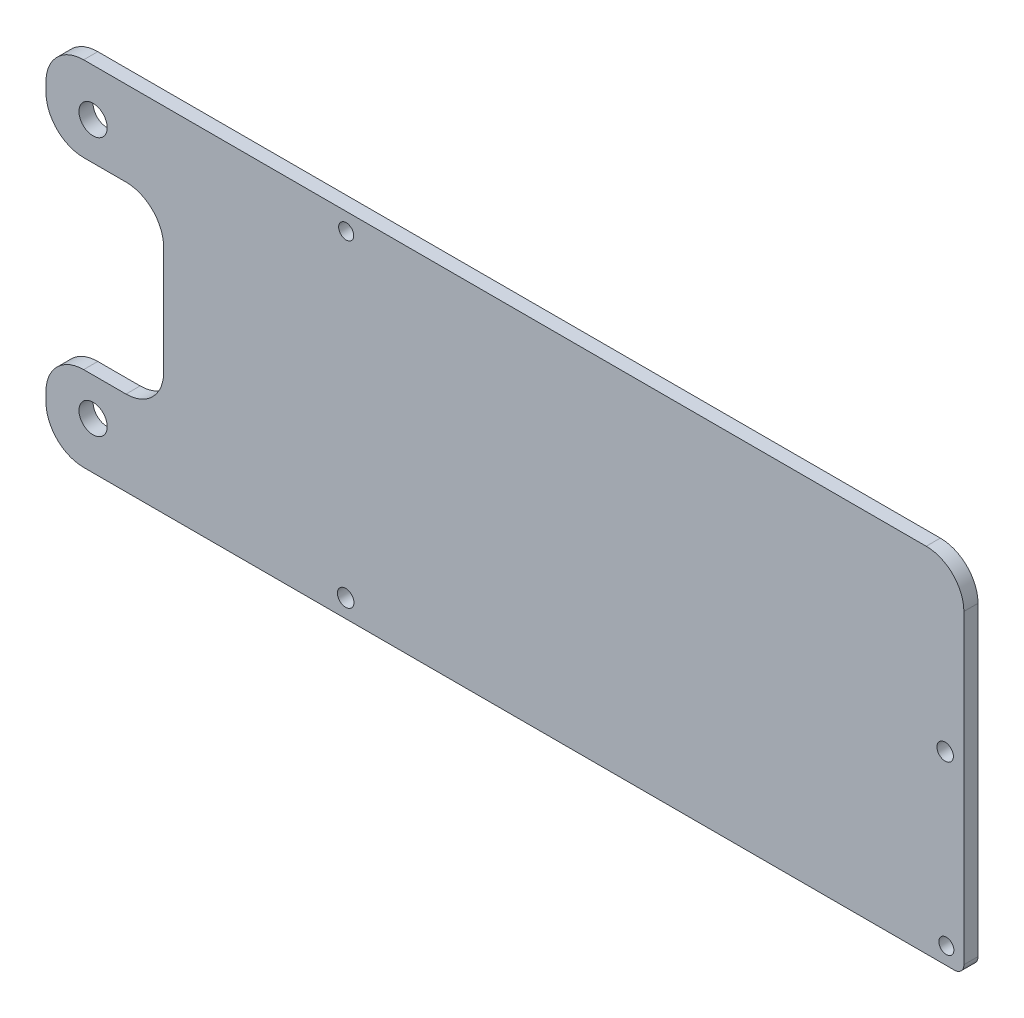
from build123d import *

# Parameters (mm, degrees)
SKETCH3_W           = 134.999984
SKETCH3_H           = 75.0000024
SKETCH3_R           = 1.5999968
SKETCH3_R_2         = 1.7499965
BOSS_EXTRUDE1_DEPTH = 3
FILLET1_R           = 8
FILLET2_R           = 2


with BuildPart() as part:
    # Sketch3 → Boss-Extrude1 (new body)
    # profile 1 of 4: a face of its own
    with BuildSketch(Plane.XY):
        with BuildLine():
            Line((10.0000054, 85.0000078), (-39.9999946, 85.0000078))
            Line((-39.9999946, 85.0000078), (-39.9999946, 78.0000078))
            ThreePointArc((-39.9999946, 78.0000078), (-37.878674256, 77.121328144), (-36.9999946, 75.0000078))
            ThreePointArc((-36.9999946, 75.0000078), (-37.878674256, 72.878687456), (-39.9999946, 72.0000078))
            Line((-39.9999946, 72.0000078), (-39.9999946, 67.0000078))
            Line((-39.9999946, 67.0000078), (-24.9999946, 67.0000078))
            Line((-24.9999946, 67.0000078), (-24.9999946, 28.0000054))
            Line((-24.9999946, 28.0000054), (-39.9999946, 28.0000054))
            Line((-39.9999946, 28.0000054), (-39.9999946, 23.0000054))
            ThreePointArc((-39.9999946, 23.0000054), (-37.878674256, 22.121325744), (-36.9999946, 20.0000054))
            ThreePointArc((-36.9999946, 20.0000054), (-37.878674256, 17.878685056), (-39.9999946, 17.0000054))
            Line((-39.9999946, 17.0000054), (-39.9999946, 10.0000054))
            Line((-39.9999946, 10.0000054), (10.0000054, 10.0000054))
            Line((10.0000054, 10.0000054), (10.0000054, 85.0000078))
        make_face()
    # profile 2 of 4: a face of its own
    with BuildSketch(Plane.XY):
        with BuildLine():
            Line((-39.9999946, 78.0000078), (-39.9999946, 85.0000078))
            Line((-39.9999946, 85.0000078), (-49.9999946, 85.0000078))
            Line((-49.9999946, 85.0000078), (-49.9999946, 67.0000078))
            Line((-49.9999946, 67.0000078), (-39.9999946, 67.0000078))
            Line((-39.9999946, 67.0000078), (-39.9999946, 72.0000078))
            ThreePointArc((-39.9999946, 72.0000078), (-42.9999946, 75.0000078), (-39.9999946, 78.0000078))
        make_face()
    # profile 3 of 4: a face of its own
    with BuildSketch(Plane.XY):
        with BuildLine():
            Line((-49.9999946, 10.0000054), (-39.9999946, 10.0000054))
            Line((-39.9999946, 10.0000054), (-39.9999946, 17.0000054))
            ThreePointArc((-39.9999946, 17.0000054), (-42.9999946, 20.0000054), (-39.9999946, 23.0000054))
            Line((-39.9999946, 23.0000054), (-39.9999946, 28.0000054))
            Line((-39.9999946, 28.0000054), (-49.9999946, 28.0000054))
            Line((-49.9999946, 28.0000054), (-49.9999946, 10.0000054))
        make_face()
    # profile 4 of 4: a face of its own
    with BuildSketch(Plane.XY):
        with Locations((77.4999974, 47.5000066)):
            Rectangle(SKETCH3_W, SKETCH3_H)
        with Locations((141.2748, 13.6144)):
            Circle(SKETCH3_R, mode=Mode.SUBTRACT)
        with Locations((141.0208, 49.2252)):
            Circle(SKETCH3_R_2, mode=Mode.SUBTRACT)
        with Locations((13.7725658, 81.3248056)):
            Circle(SKETCH3_R, mode=Mode.SUBTRACT)
        with Locations((13.6652, 13.843)):
            Circle(SKETCH3_R_2, mode=Mode.SUBTRACT)
    extrude(amount=BOSS_EXTRUDE1_DEPTH)

    # Fillet1
    fillet1_edges = [part.edges().sort_by_distance(p)[0] for p in [
        (144.9999894, 85.0000078, 1.5),
        (-49.9999946, 10.0000054, 1.5),
        (-49.9999946, 28.0000054, 1.5),
        (-24.9999946, 28.0000054, 1.5),
        (-24.9999946, 67.0000078, 1.5),
        (-49.9999946, 67.0000078, 1.5),
        (-49.9999946, 85.0000078, 1.5),
    ]]
    fillet(fillet1_edges, radius=FILLET1_R)

    # Fillet2
    fillet2_edges = [part.edges().sort_by_distance(p)[0] for p in [
        (144.9999894, 10.0000054, 1.5),
    ]]
    fillet(fillet2_edges, radius=FILLET2_R)


solid = part.part
